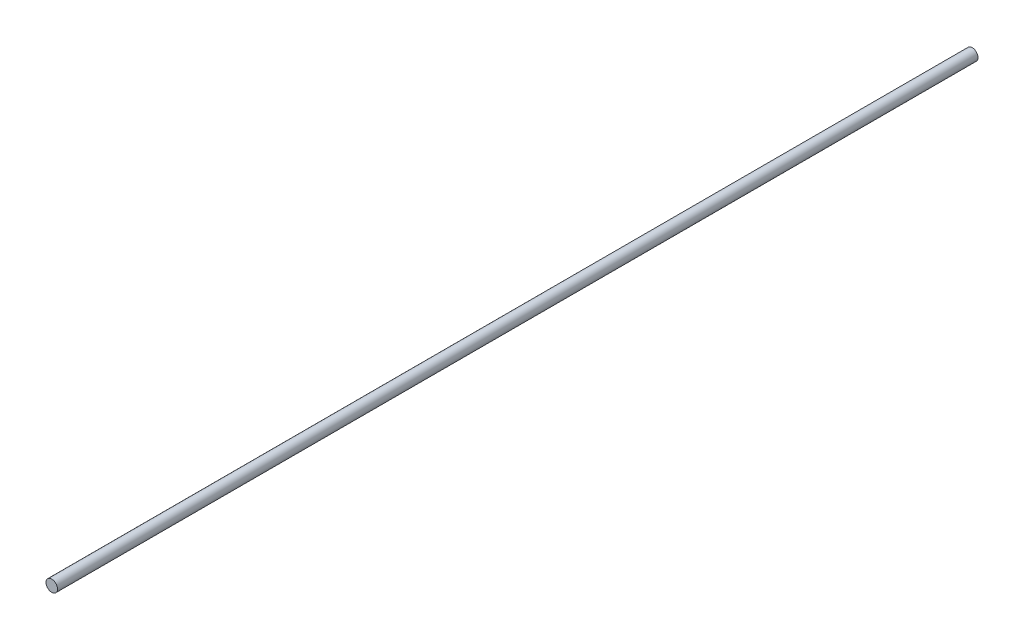
from build123d import *

# Parameters (mm, degrees)
SKETCH1_R           = 3.175
BOSS_EXTRUDE1_DEPTH = 254


with BuildPart() as part:
    # Sketch1 → Boss-Extrude1 (new, symmetric)
    with BuildSketch(Plane.XY):
        Circle(SKETCH1_R)
    extrude(amount=BOSS_EXTRUDE1_DEPTH, both=True)


solid = part.part
